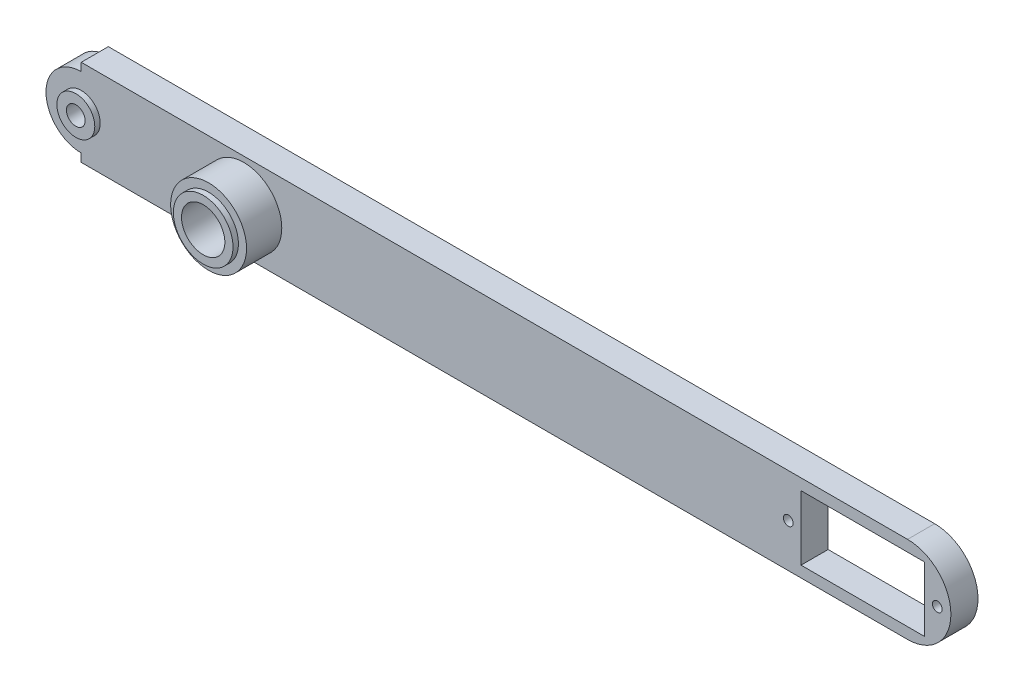
from build123d import *

# Parameters (mm, degrees)
BOSS_EXTRUDE1_START     = -9
SKETCH1_W               = 152.45
SKETCH1_H               = 16
BOSS_EXTRUDE1_DEPTH     = 5
BOSS_EXTRUDE2_START     = -9
SKETCH2_R               = 6.5
BOSS_EXTRUDE2_DEPTH     = 5
BOSS_EXTRUDE3_START     = -9
SKETCH3_R               = 8
BOSS_EXTRUDE3_DEPTH     = 5
BOSS_EXTRUDE4_START     = -9
SKETCH4_R               = 7
BOSS_EXTRUDE4_DEPTH     = 11.5
BOSS_EXTRUDE5_START     = 2.5
SKETCH5_R               = 5.5
BOSS_EXTRUDE5_DEPTH     = 1
BOSS_EXTRUDE6_START     = -4
SKETCH6_R               = 3.5
BOSS_EXTRUDE6_DEPTH     = 1
CUT_EXTRUDE1_DEPTH      = 132.004589614
CUT_EXTRUDE1_DEPTH_BACK = 132.004589614
SKETCH7_R               = 4
CUT_EXTRUDE2_DEPTH      = 132.004589614
CUT_EXTRUDE2_DEPTH_BACK = 132.004589614
SKETCH8_R               = 1.725
CUT_EXTRUDE3_DEPTH      = 132.004589614
CUT_EXTRUDE3_DEPTH_BACK = 132.004589614
SKETCH9_W               = 22.8
SKETCH9_H               = 11.9
CUT_EXTRUDE4_DEPTH      = 132.004589614
CUT_EXTRUDE4_DEPTH_BACK = 132.004589614
SKETCH10_R              = 0.9
CUT_EXTRUDE5_START      = -9
SKETCH11_R              = 2
CUT_EXTRUDE5_DEPTH      = 4


with BuildPart() as part:
    # Sketch1 → Boss-Extrude1 (new body)
    with BuildSketch(Plane.XY.offset(BOSS_EXTRUDE1_START)):
        with Locations((46.225, 0)):
            Rectangle(SKETCH1_W, SKETCH1_H)
    extrude(amount=BOSS_EXTRUDE1_DEPTH)

    # Sketch2 → Boss-Extrude2 (add)
    with BuildSketch(Plane.XY.offset(BOSS_EXTRUDE2_START)):
        with Locations((-30, 0)):
            Circle(SKETCH2_R)
    extrude(amount=BOSS_EXTRUDE2_DEPTH)

    # Sketch3 → Boss-Extrude3 (add)
    with BuildSketch(Plane.XY.offset(BOSS_EXTRUDE3_START)):
        with Locations((122.45, 0)):
            Circle(SKETCH3_R)
    extrude(amount=BOSS_EXTRUDE3_DEPTH)

    # Sketch4 → Boss-Extrude4 (add)
    with BuildSketch(Plane.XY.offset(BOSS_EXTRUDE4_START)):
        Circle(SKETCH4_R)
    extrude(amount=BOSS_EXTRUDE4_DEPTH)

    # Sketch5 → Boss-Extrude5 (add)
    with BuildSketch(Plane.XY.offset(BOSS_EXTRUDE5_START)):
        Circle(SKETCH5_R)
    extrude(amount=BOSS_EXTRUDE5_DEPTH)

    # Sketch6 → Boss-Extrude6 (add)
    with BuildSketch(Plane.XY.offset(BOSS_EXTRUDE6_START)):
        with Locations((-30, 0)):
            Circle(SKETCH6_R)
    extrude(amount=BOSS_EXTRUDE6_DEPTH)

    # Sketch7 → Cut-Extrude1 (cut, two sides: drawn at the far end of the back side and taken through both)
    with BuildSketch(Plane.XY.offset(-CUT_EXTRUDE1_DEPTH_BACK)):
        Circle(SKETCH7_R)
    extrude(amount=CUT_EXTRUDE1_DEPTH + CUT_EXTRUDE1_DEPTH_BACK, mode=Mode.SUBTRACT)

    # Sketch8 → Cut-Extrude2 (cut, two sides: drawn at the far end of the back side and taken through both)
    with BuildSketch(Plane.XY.offset(-CUT_EXTRUDE2_DEPTH_BACK)):
        with Locations((-30, 0)):
            Circle(SKETCH8_R)
    extrude(amount=CUT_EXTRUDE2_DEPTH + CUT_EXTRUDE2_DEPTH_BACK, mode=Mode.SUBTRACT)

    # Sketch9 → Cut-Extrude3 (cut, two sides: drawn at the far end of the back side and taken through both)
    with BuildSketch(Plane.XY.offset(-CUT_EXTRUDE3_DEPTH_BACK)):
        with Locations((114.2, 0)):
            Rectangle(SKETCH9_W, SKETCH9_H)
    extrude(amount=CUT_EXTRUDE3_DEPTH + CUT_EXTRUDE3_DEPTH_BACK, mode=Mode.SUBTRACT)

    # Sketch10 → Cut-Extrude4 (cut, two sides: drawn at the far end of the back side and taken through both)
    with BuildSketch(Plane.XY.offset(-CUT_EXTRUDE4_DEPTH_BACK)):
        with Locations((100.45, 0)):
            Circle(SKETCH10_R)
        with Locations((127.95, 0)):
            Circle(SKETCH10_R)
    extrude(amount=CUT_EXTRUDE4_DEPTH + CUT_EXTRUDE4_DEPTH_BACK, mode=Mode.SUBTRACT)

    # Sketch11 → Cut-Extrude5 (cut)
    with BuildSketch(Plane.XY.offset(CUT_EXTRUDE5_START)):
        with Locations((40, 0)):
            Circle(SKETCH11_R)
        with Locations((75, 0)):
            Circle(SKETCH11_R)
    extrude(amount=CUT_EXTRUDE5_DEPTH, mode=Mode.SUBTRACT)


solid = part.part
